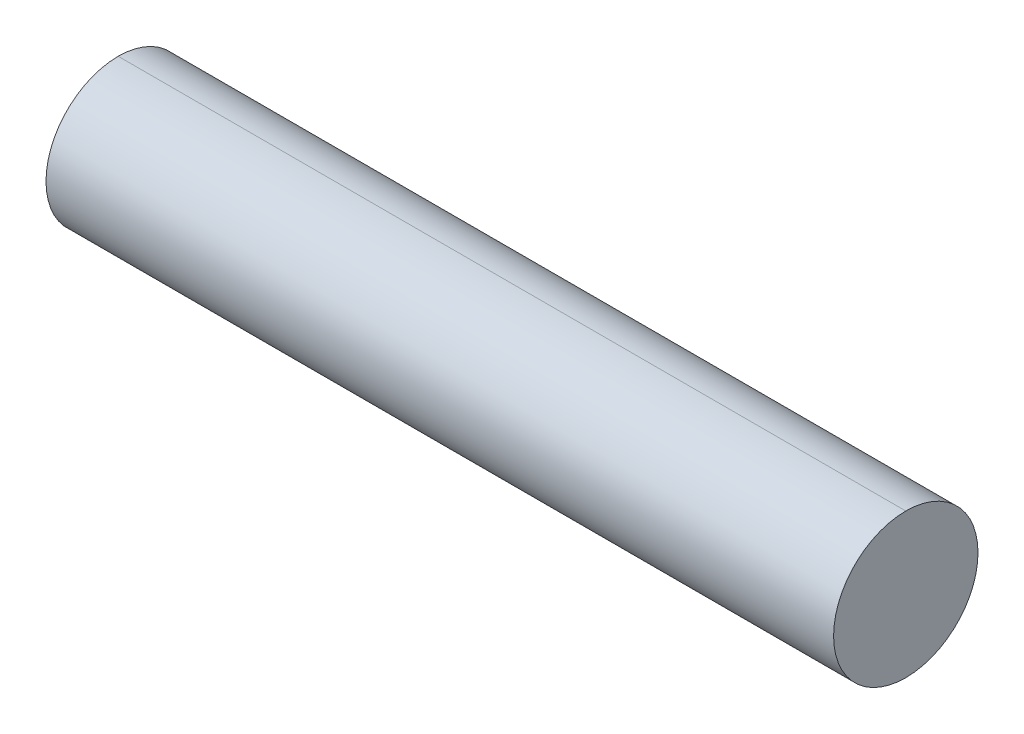
from build123d import *

# Parameters (mm, degrees)
SKETCH1_R           = 19.05
BOSS_EXTRUDE1_DEPTH = 228.6
CUT_EXTRUDE1_START  = -20.8
CUT_EXTRUDE1_DEPTH  = 20.8


with BuildPart() as part:
    # Sketch1 → Boss-Extrude1 (new body)
    with BuildSketch(Plane(origin=(0, 0, 0), x_dir=(0, 0, -1), z_dir=(1, 0, 0))):
        Circle(SKETCH1_R)
    extrude(amount=BOSS_EXTRUDE1_DEPTH)

    # Sketch2 → Cut-Extrude1 (cut)
    with BuildSketch(Plane.ZY.offset(CUT_EXTRUDE1_START)):
        with BuildLine():
            ThreePointArc((0, -19.05), (19.05, 0), (0, 19.05))
            ThreePointArc((0, 19.05), (-19.05, 0), (0, -19.05))
        make_face()
    extrude(amount=CUT_EXTRUDE1_DEPTH, mode=Mode.SUBTRACT)


solid = part.part
